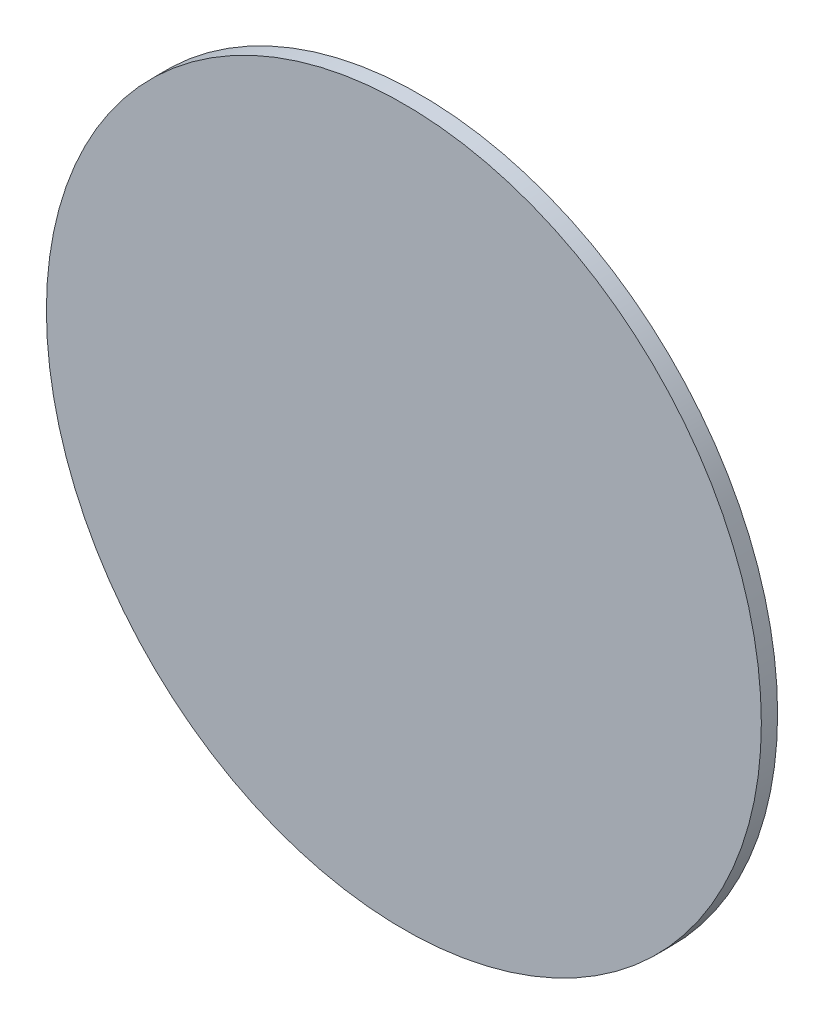
from build123d import *

# Parameters (mm, degrees)
SKETCH_1_R      = 110
EXTRUDE_1_DEPTH = 5


with BuildPart() as part:
    # 草图1 → 凸台-拉伸1 (new body)
    with BuildSketch(Plane.XY):
        Circle(SKETCH_1_R)
    extrude(amount=EXTRUDE_1_DEPTH)


solid = part.part
